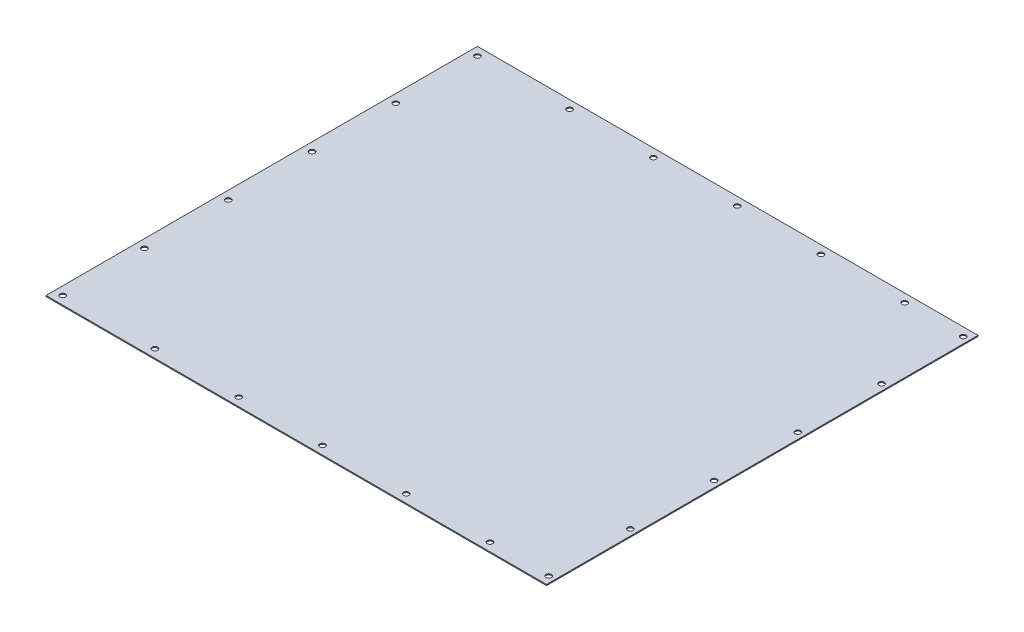
from build123d import *

# Parameters (mm, degrees)
SKETCH1_W                        = 758.825
SKETCH1_H                        = 654.05
BOSS_EXTRUDE1_DEPTH              = 1.5875
F_21_64_0_32813_DIAMETER_HOLE1_D = 8.334502
LPATTERN1_COUNT                  = 2
LPATTERN1_PITCH                  = 736.6
LPATTERN1_COUNT_DIR2             = 2
LPATTERN1_PITCH_DIR2             = 628.65
F_21_64_0_32813_DIAMETER_HOLE2_D = 8.334502
LPATTERN2_COUNT                  = 5
LPATTERN2_PITCH                  = 127
LPATTERN2_COUNT_DIR2             = 2
LPATTERN2_PITCH_DIR2             = 628.65
F_21_64_0_32813_DIAMETER_HOLE3_D = 8.334502
LPATTERN6_COUNT                  = 4
LPATTERN6_PITCH                  = 127
LPATTERN6_COUNT_DIR2             = 2
LPATTERN6_PITCH_DIR2             = 736.6


with BuildPart() as part:
    # Sketch1 → Boss-Extrude1 (new body)
    with BuildSketch(Plane(origin=(0, 0, 0), x_dir=(1, 0, 0), z_dir=(0, 1, 0))):
        with Locations((379.4125, 327.025)):
            Rectangle(SKETCH1_W, SKETCH1_H)
    extrude(amount=BOSS_EXTRUDE1_DEPTH)

    # 21/64 (0.32813) Diameter Hole1 (through all)
    with Locations(Plane(origin=(0, 1.5875, 0), x_dir=(1, 0, 0), z_dir=(0, 1, 0))):
        with Locations((12.7, 12.7)):
            f_21_64_0_32813_diameter_hole1 = Hole(F_21_64_0_32813_DIAMETER_HOLE1_D / 2)

    # LPattern1: 21_64 _0.32813_ Diameter Hole1 2 × 2
    with Locations(*[(i * LPATTERN1_PITCH, 0, -j * LPATTERN1_PITCH_DIR2) for i in range(LPATTERN1_COUNT) for j in range(LPATTERN1_COUNT_DIR2) if (i, j) != (0, 0)]):
        add(f_21_64_0_32813_diameter_hole1, mode=Mode.SUBTRACT)

    # 21/64 (0.32813) Diameter Hole2 (through all)
    with Locations(Plane(origin=(0, 1.5875, 0), x_dir=(1, 0, 0), z_dir=(0, 1, 0))):
        with Locations((152.4, 12.7)):
            f_21_64_0_32813_diameter_hole2 = Hole(F_21_64_0_32813_DIAMETER_HOLE2_D / 2)

    # LPattern2: 21_64 _0.32813_ Diameter Hole2 5 × 2
    with Locations(*[(i * LPATTERN2_PITCH, 0, -j * LPATTERN2_PITCH_DIR2) for i in range(LPATTERN2_COUNT) for j in range(LPATTERN2_COUNT_DIR2) if (i, j) != (0, 0)]):
        add(f_21_64_0_32813_diameter_hole2, mode=Mode.SUBTRACT)

    # 21/64 (0.32813) Diameter Hole3 (through all)
    with Locations(Plane(origin=(0, 1.5875, 0), x_dir=(1, 0, 0), z_dir=(0, 1, 0))):
        with Locations((12.7, 136.525)):
            f_21_64_0_32813_diameter_hole3 = Hole(F_21_64_0_32813_DIAMETER_HOLE3_D / 2)

    # LPattern6: 21_64 _0.32813_ Diameter Hole3 4 × 2
    with Locations(*[(j * LPATTERN6_PITCH_DIR2, 0, -i * LPATTERN6_PITCH) for i in range(LPATTERN6_COUNT) for j in range(LPATTERN6_COUNT_DIR2) if (i, j) != (0, 0)]):
        add(f_21_64_0_32813_diameter_hole3, mode=Mode.SUBTRACT)


solid = part.part
